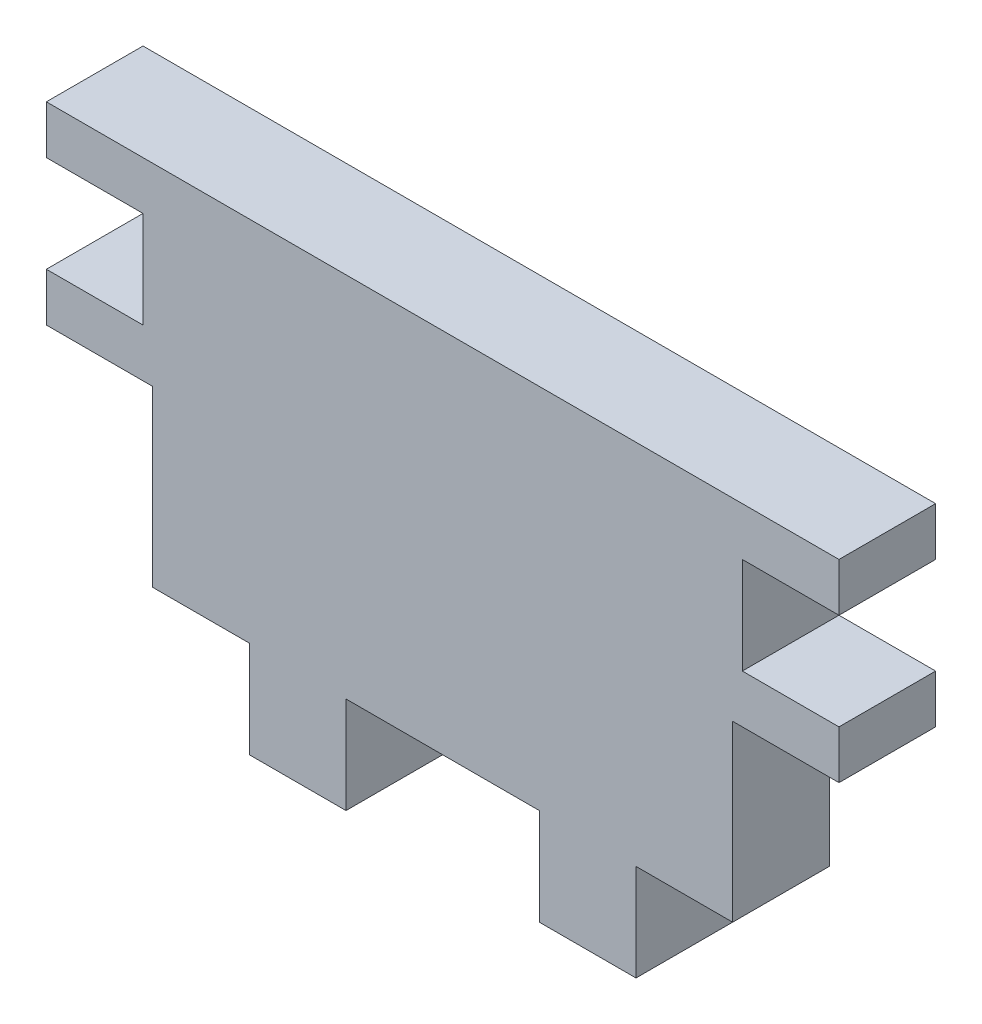
from build123d import *

# Parameters (mm, degrees)
BOSS_EXTRU_1_DEPTH = 5


with BuildPart() as part:
    # Esquisse1 → Boss.-Extru.1 (new body)
    with BuildSketch(Plane.XY):
        Polygon((-21.401470553, 26.519094535), (-21.401470553, 7.519094535), (-16.401470553, 7.519094535), (-16.401470553, 2.519094535), (-11.401470553, 2.519094535), (-11.401470553, 7.519094535), (-6.401470553, 7.519094535), (-6.401470553, 16.519094535), (-0.901470553, 16.519094535), (-0.901470553, 19.019094535), (-5.901470553, 19.019094535), (-5.901470553, 24.019094535), (-0.901470553, 24.019094535), (-0.901470553, 26.519094535), align=None)
        Polygon((-41.901470553, 16.519094535), (-36.401470553, 16.519094535), (-36.401470553, 7.519094535), (-31.401470553, 7.519094535), (-31.401470553, 2.519094535), (-26.401470553, 2.519094535), (-26.401470553, 7.519094535), (-21.401470553, 7.519094535), (-21.401470553, 26.519094535), (-41.901470553, 26.519094535), (-41.901470553, 24.019094535), (-36.901470553, 24.019094535), (-36.901470553, 19.019094535), (-41.901470553, 19.019094535), align=None)
    extrude(amount=BOSS_EXTRU_1_DEPTH)


solid = part.part
